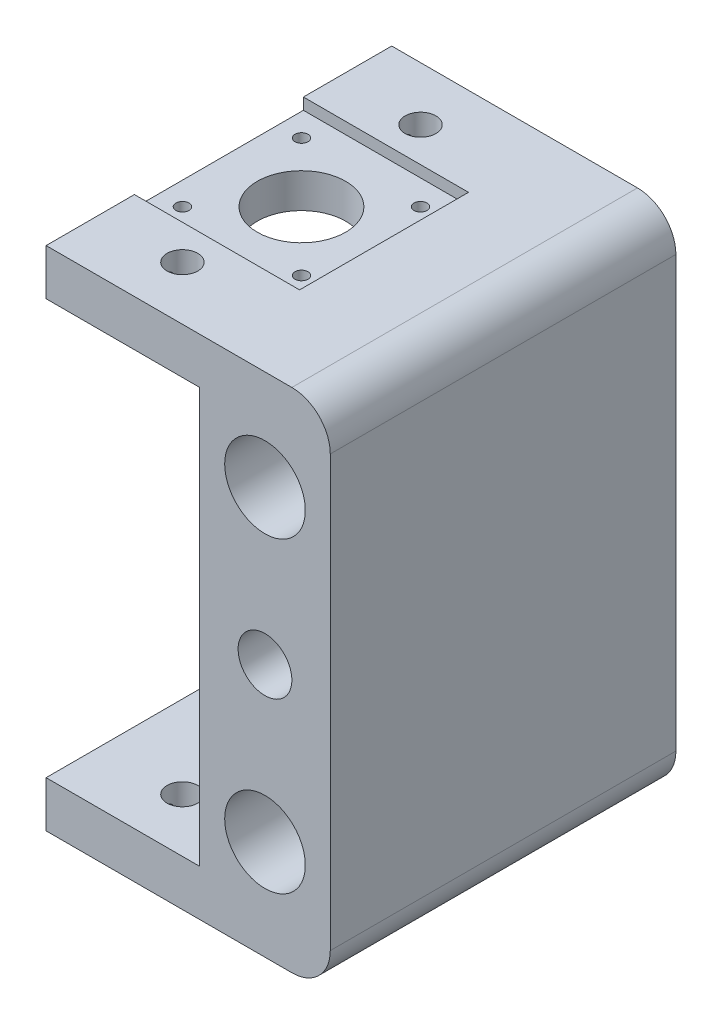
from build123d import *

# Parameters (mm, degrees)
SKETCH1_R             = 10.5
SKETCH1_R_2           = 7
BOSS_EXTRUDE1_DEPTH   = 90
SKETCH2_R             = 11.5
CUT_EXTRUDE1_DEPTH    = 6
SKETCH3_R             = 1.5
CUT_EXTRUDE2_DEPTH    = 40
SKETCH4_W             = 43
SKETCH4_H             = 44
CUT_EXTRUDE3_DEPTH    = 3
SKETCH5_R             = 11.5
CUT_EXTRUDE4_DEPTH    = 9
CIRPATTERN1_COUNT     = 4
SKETCH9_R             = 4
SKETCH9_R_2           = 5
CUT_EXTRUDE5_DEPTH    = 177.068168617
SKETCH10_R            = 12
CUT_EXTRUDE6_DEPTH    = 8
M4_TAPPED_HOLE1_D     = 3.3
M4_TAPPED_HOLE1_DEPTH = 19.008579979
M4_TAPPED_HOLE1_TIP   = 0.991420021


with BuildPart() as part:
    # Sketch1 → Boss-Extrude1 (new body)
    with BuildSketch(Plane.XY):
        with BuildLine():
            Line((0, 0), (64, 0))
            ThreePointArc((64, 0), (71.071067812, 2.928932188), (74, 10))
            Line((74, 10), (74, 122))
            ThreePointArc((74, 122), (71.071067812, 129.071067812), (64, 132))
            Line((64, 132), (0, 132))
            Line((0, 132), (0, 120))
            Line((0, 120), (40, 120))
            Line((40, 120), (40, 12))
            Line((40, 12), (0, 12))
            Line((0, 12), (0, 0))
        make_face()
        with Locations(Location((57, 106, 0), (0, 0, 180))):
            Circle(SKETCH1_R, mode=Mode.SUBTRACT)
        with Locations(Location((57, 66, 0), (0, 0, 180))):
            Circle(SKETCH1_R_2, mode=Mode.SUBTRACT)
        with Locations(Location((57, 26, 0), (0, 0, 180))):
            Circle(SKETCH1_R, mode=Mode.SUBTRACT)
    extrude(amount=BOSS_EXTRUDE1_DEPTH)

    # Sketch2 → Cut-Extrude1 (cut)
    with BuildSketch(Plane(origin=(0, 0, 0), x_dir=(-1, 0, 0), z_dir=(0, 0, -1))):
        with Locations((-57, 66)):
            Circle(SKETCH2_R)
    extrude(amount=-CUT_EXTRUDE1_DEPTH, mode=Mode.SUBTRACT)

    # Sketch3 → Cut-Extrude2 (cut)
    with BuildSketch(Plane(origin=(0, 0, 6), x_dir=(-1, 0, 0), z_dir=(0, 0, -1))):
        with Locations((-57, 74)):
            Circle(SKETCH3_R)
        with Locations((-49, 66)):
            Circle(SKETCH3_R)
        with Locations((-57, 58)):
            Circle(SKETCH3_R)
        with Locations((-65, 66)):
            Circle(SKETCH3_R)
    extrude(amount=-CUT_EXTRUDE2_DEPTH, mode=Mode.SUBTRACT)

    # Sketch4 → Cut-Extrude3 (cut)
    with BuildSketch(Plane(origin=(0, 132, 0), x_dir=(1, 0, 0), z_dir=(0, 1, 0))):
        with Locations((21.5, -45)):
            Rectangle(SKETCH4_W, SKETCH4_H)
    extrude(amount=-CUT_EXTRUDE3_DEPTH, mode=Mode.SUBTRACT)

    # Sketch5 → Cut-Extrude4 (cut)
    with BuildSketch(Plane(origin=(0, 129, 0), x_dir=(1, 0, 0), z_dir=(0, 1, 0))):
        with Locations(Location((21.5, -45, 0), (0, 0, 270))):
            Circle(SKETCH5_R)
    extrude(amount=-CUT_EXTRUDE4_DEPTH, mode=Mode.SUBTRACT)

    # Sketch7 → CBORE for M3 Pan Head Screw1 (revolve, cut)
    with BuildSketch(Plane(origin=(6, 120, 29.5), x_dir=(0, 0, -1), z_dir=(1, 0, 0))):
        Polygon((0, 0), (0, 21.021463052), (1.7, 20), (1.7, 3), (2.75, 3), (2.75, 0), align=None)
    cbore_for_m3_pan_head_screw1 = revolve(axis=Axis((6, 113.65, 29.5), (0, 1, 0)), mode=Mode.SUBTRACT)

    # CirPattern1: CBORE for M3 Pan Head Screw1 ×4 about axis
    cirpattern1_axis = Axis((21.5, 0, 45), (0, 1, 0))
    for i in range(1, CIRPATTERN1_COUNT):
        add(cbore_for_m3_pan_head_screw1.rotate(cirpattern1_axis, i * 360 / CIRPATTERN1_COUNT), mode=Mode.SUBTRACT)

    # Sketch9 → Cut-Extrude5 (cut, through all)
    with BuildSketch(Plane(origin=(0, 132, 0), x_dir=(1, 0, 0), z_dir=(0, 1, 0))):
        with Locations(Location((21.5, -14, 0), (0, 0, 270))):
            Circle(SKETCH9_R)
        with Locations(Location((21.5, -76, 0), (0, 0, 270))):
            Circle(SKETCH9_R)
        with Locations(Location((21.5, -45, 0), (0, 0, 270))):
            Circle(SKETCH9_R_2)
    extrude(amount=-CUT_EXTRUDE5_DEPTH, mode=Mode.SUBTRACT)

    # Sketch10 → Cut-Extrude6 (cut)
    with BuildSketch(Plane(origin=(0, 12, 0), x_dir=(1, 0, 0), z_dir=(0, 1, 0))):
        with Locations(Location((21.5, -45, 0), (0, 0, 180))):
            Circle(SKETCH10_R)
    extrude(amount=-CUT_EXTRUDE6_DEPTH, mode=Mode.SUBTRACT)

    # M4 Tapped Hole1
    with Locations(Plane.ZY):
        with Locations((14, 126), (76, 126), (76, 6), (14, 6)):
            Hole(M4_TAPPED_HOLE1_D / 2, depth=M4_TAPPED_HOLE1_DEPTH)
            with Locations((0, 0, -(M4_TAPPED_HOLE1_DEPTH + M4_TAPPED_HOLE1_TIP / 2))):  # 118° drill point
                Cone(0, M4_TAPPED_HOLE1_D / 2, M4_TAPPED_HOLE1_TIP, mode=Mode.SUBTRACT)


solid = part.part
